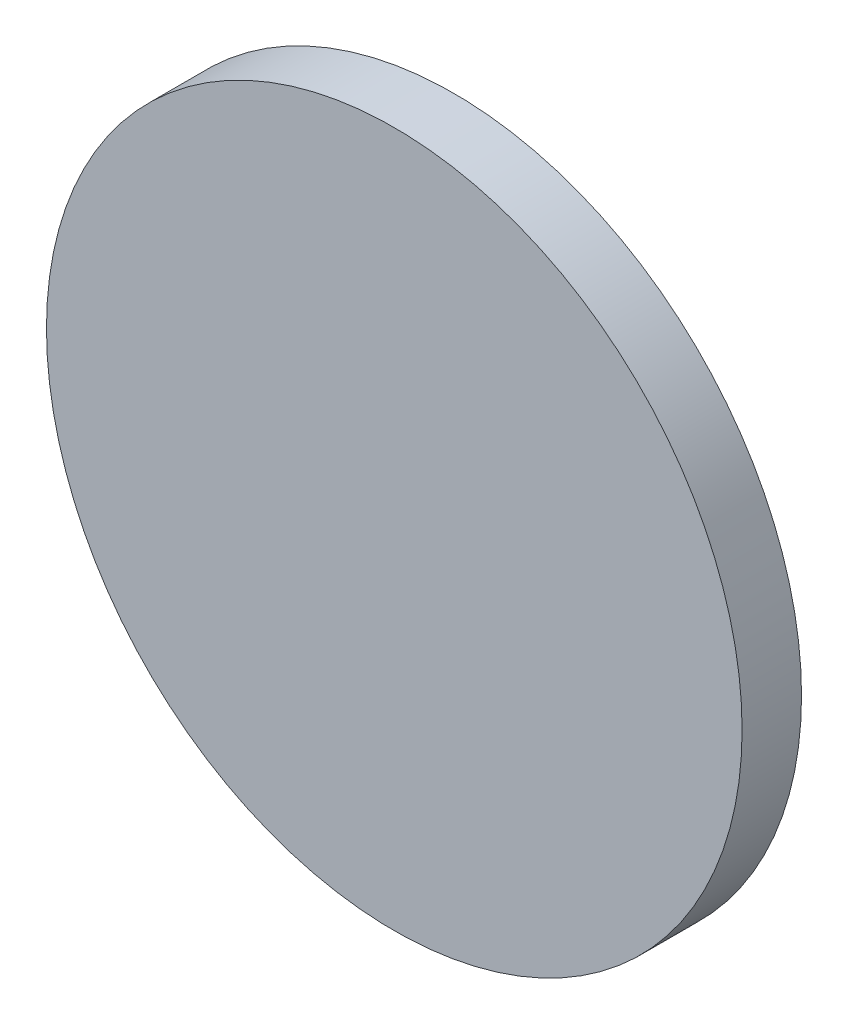
from build123d import *

# Parameters (mm, degrees)
ESQUISSE1_R             = 12.875
BOSS_EXTRU_1_DEPTH      = 2.2
ENL_V_MAT_EXTRU_1_DEPTH = 0.15


with BuildPart() as part:
    # Esquisse1 → Boss.-Extru.1 (new body)
    with BuildSketch(Plane.XY):
        Circle(ESQUISSE1_R)
    extrude(amount=BOSS_EXTRU_1_DEPTH)

    # Esquisse2 → Enlèv. mat.-Extru.1 (cut)
    with BuildSketch(Plane(origin=(0, 0, 0), x_dir=(-1, 0, 0), z_dir=(0, 0, -1))):
        with BuildLine():
            Line((-0.904447115, 1.53394505), (-1.538461538, 1.53394505))
            add(Edge.make_bspline(
                [(-1.538461538, 1.53394505), (-1.535483382, 1.598459427), (-1.529658516, 1.724640697), (-1.50379311, 1.908500904), (-1.461892993, 2.08174412), (-1.409006202, 2.245838985), (-1.338456695, 2.398734226), (-1.257056677, 2.543095198), (-1.158788153, 2.67589638), (-1.047739352, 2.797347851), (-0.927191956, 2.90769124), (-0.797602942, 3.002838248), (-0.661162761, 3.083917548), (-0.517844585, 3.150078794), (-0.36736774, 3.201306183), (-0.210161142, 3.23858307), (-0.045723284, 3.261004233), (0.066369837, 3.263466167), (0.123197115, 3.264714281)],
                knots=[0, 0, 0, 0, 1.154964179, 2.258951466, 3.315045469, 4.34063582, 5.337653555, 6.322213479, 7.300594401, 8.285733883, 9.262436119, 10.219305053, 11.156568068, 12.097250375, 13.037875795, 13.995471444, 14.983774372, 16, 16, 16, 16], degree=3))
            add(Edge.make_bspline(
                [(0.123197115, 3.264714281), (0.182695398, 3.263497204), (0.299447482, 3.261108962), (0.469466636, 3.238635314), (0.630374203, 3.202396573), (0.782217295, 3.15290748), (0.924719266, 3.086826653), (1.058161121, 3.007140463), (1.181260152, 2.911360539), (1.294909804, 2.804188786), (1.395291833, 2.686298975), (1.485957423, 2.565094244), (1.560901311, 2.438116426), (1.623685397, 2.307684161), (1.671998742, 2.17272694), (1.706117474, 2.033793979), (1.726568813, 1.89079087), (1.729360203, 1.794093658), (1.730769231, 1.745283191)],
                knots=[0, 0, 0, 0, 1.156722346, 2.269809107, 3.328396062, 4.361258308, 5.3694338, 6.377253737, 7.377324894, 8.397019439, 9.4098266, 10.385180797, 11.337325354, 12.27255833, 13.196816462, 14.119704983, 15.050871513, 16, 16, 16, 16], degree=3))
            add(Edge.make_bspline(
                [(1.730769231, 1.745283191), (1.728205226, 1.677005358), (1.723112342, 1.541385042), (1.683895559, 1.340742568), (1.617967551, 1.14656255), (1.541814394, 0.988449086), (1.464794664, 0.86064372), (1.394114185, 0.755151869), (1.311082908, 0.641083154), (1.213920187, 0.519201159), (1.106489605, 0.386717178), (0.984523598, 0.247048886), (0.851797199, 0.0973686), (0.757138795, -0.003419183), (0.708133013, -0.055598219)],
                knots=[0, 0, 0, 0, 1.155755081, 2.295677249, 3.447123235, 4.6205014, 5.259503175, 5.973005395, 6.77029923, 7.648035671, 8.612336498, 9.658570495, 10.787814065, 12, 12, 12, 12], degree=3))
            Line((0.708133013, -0.055598219), (-0.521834936, -1.28656777))
            Line((-0.521834936, -1.28656777), (1.794871795, -1.28656777))
            Line((1.794871795, -1.28656777), (1.794871795, -1.863490847))
            Line((1.794871795, -1.863490847), (-1.730769231, -1.863490847))
            Line((-1.730769231, -1.863490847), (0.182291667, 0.24888896))
            add(Edge.make_bspline(
                [(0.182291667, 0.24888896), (0.227858241, 0.297485202), (0.315301331, 0.390742277), (0.438539985, 0.527255661), (0.549728842, 0.653460154), (0.64946069, 0.769264649), (0.735123959, 0.876225683), (0.809023164, 0.97276967), (0.870321749, 1.059352512), (0.933980622, 1.161267724), (0.997060035, 1.283436349), (1.050720551, 1.432464917), (1.082919489, 1.584655413), (1.087467776, 1.687041396), (1.08974359, 1.738271973)],
                knots=[0, 0, 0, 0, 1.341560447, 2.574479018, 3.703506985, 4.728875774, 5.651874962, 6.462761537, 7.177175968, 7.787249671, 8.88179658, 9.938774664, 10.968630673, 12, 12, 12, 12], degree=3))
            add(Edge.make_bspline(
                [(1.08974359, 1.738271973), (1.089182734, 1.770053483), (1.088072967, 1.832939638), (1.072943119, 1.92502887), (1.051630011, 2.014350301), (1.018666087, 2.099467911), (0.978950625, 2.182056297), (0.929273647, 2.261047824), (0.86962043, 2.335709759), (0.803261839, 2.40772195), (0.729867494, 2.472740803), (0.652345526, 2.531053203), (0.569742603, 2.578410458), (0.484317211, 2.619825206), (0.393413852, 2.649185553), (0.299267039, 2.671045841), (0.201137532, 2.686188903), (0.13427309, 2.687249904), (0.100160256, 2.687791204)],
                knots=[0, 0, 0, 0, 0.999432927, 1.977580462, 2.931018689, 3.885672852, 4.844657058, 5.812871023, 6.815890212, 7.849665183, 8.891901864, 9.898878619, 10.897592748, 11.885014695, 12.882178885, 13.896915602, 14.927050508, 16, 16, 16, 16], degree=3))
            add(Edge.make_bspline(
                [(0.100160256, 2.687791204), (0.067729357, 2.68712604), (0.003929265, 2.685817488), (-0.090032164, 2.67231626), (-0.180223502, 2.650333606), (-0.266949004, 2.61984166), (-0.350836809, 2.582223424), (-0.429835719, 2.533489074), (-0.505236946, 2.476796008), (-0.578037313, 2.413166576), (-0.644294043, 2.338516583), (-0.703555767, 2.25373065), (-0.755886208, 2.158716392), (-0.80061588, 2.053640023), (-0.837685545, 1.938225876), (-0.867422698, 1.812614288), (-0.890412391, 1.676750596), (-0.89968233, 1.582427495), (-0.904447115, 1.53394505)],
                knots=[0, 0, 0, 0, 0.911540883, 1.79324023, 2.663162255, 3.518366492, 4.375475705, 5.243419306, 6.122264358, 7.02676621, 7.957780629, 8.921596253, 9.930241338, 11.002848587, 12.128200329, 13.335197372, 14.630280975, 16, 16, 16, 16], degree=3))
        make_face()
    extrude(amount=-ENL_V_MAT_EXTRU_1_DEPTH, mode=Mode.SUBTRACT)


solid = part.part
